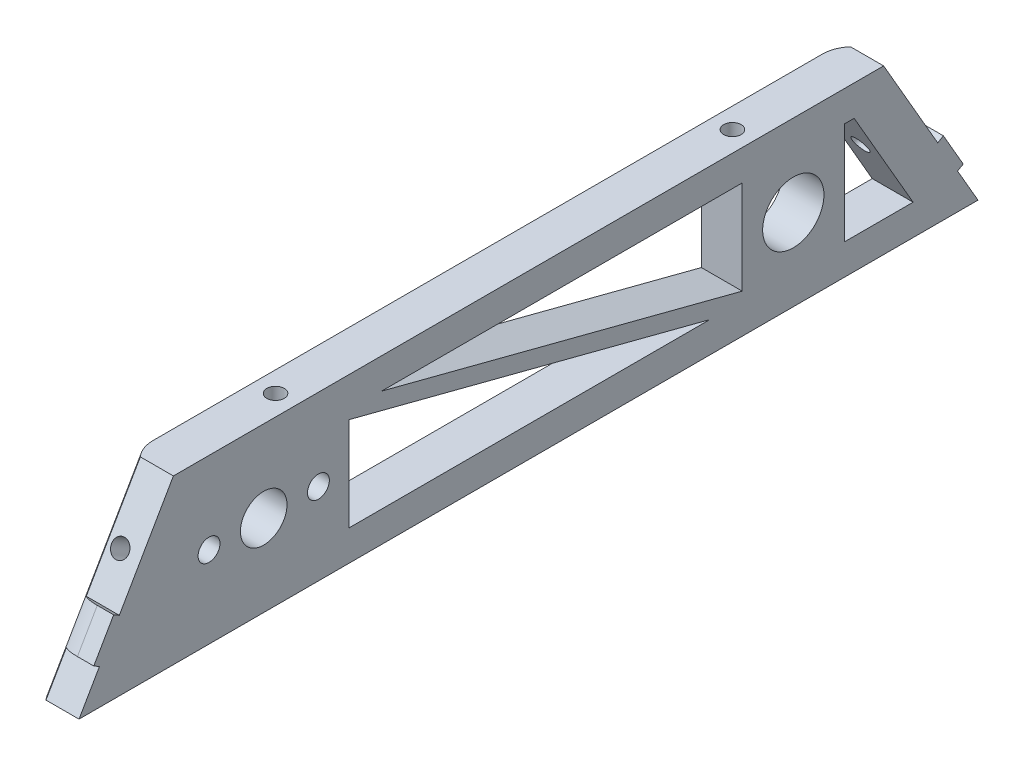
from build123d import *

# Parameters (mm, degrees)
SKETCH1_R                     = 3.6195
SKETCH1_R_2                   = 4.7625
SKETCH1_R_3                   = 1.6999966
BOSS_EXTRUDE1_DEPTH           = 6.35
TAP_DRILL_FOR_6_32_TAP4_D     = 2.7051
TAP_DRILL_FOR_6_32_TAP4_DEPTH = 10.16
TAP_DRILL_FOR_6_32_TAP4_TIP   = 0.81269403
TAP_DRILL_FOR_6_32_TAP3_D     = 2.7051
TAP_DRILL_FOR_6_32_TAP3_DEPTH = 10.16
TAP_DRILL_FOR_6_32_TAP3_TIP   = 0.81269403
SKETCH11_W                    = 6.35
SKETCH11_H                    = 6.1722
BOSS_EXTRUDE2_DEPTH           = 1.016
SKETCH12_W                    = 6.35
SKETCH12_H                    = 6.1722
BOSS_EXTRUDE3_DEPTH           = 1.016
TAP_DRILL_FOR_6_32_TAP1_D     = 2.7051
TAP_DRILL_FOR_6_32_TAP1_DEPTH = 7.62
TAP_DRILL_FOR_6_32_TAP1_TIP   = 0.81269403
TAP_DRILL_FOR_6_32_TAP2_D     = 2.7051
TAP_DRILL_FOR_6_32_TAP2_DEPTH = 7.62
TAP_DRILL_FOR_6_32_TAP2_TIP   = 0.81269403
CUT_EXTRUDE1_DEPTH            = 143.132235964
FILLET1_R                     = 3.81


with BuildPart() as part:
    # Sketch1 → Boss-Extrude1 (new body)
    with BuildSketch(Plane(origin=(0, 0, 0), x_dir=(0, 0, -1), z_dir=(1, 0, 0))):
        Polygon((0, 0), (-14.664696837, 25.4), (-125.035303163, 25.4), (-139.7, 0), align=None)
        with Locations((-110.998, 12.7)):
            Circle(SKETCH1_R, mode=Mode.SUBTRACT)
        with Locations((-28.702, 12.7)):
            Circle(SKETCH1_R_2, mode=Mode.SUBTRACT)
        with Locations((-102.4979916, 12.7)):
            Circle(SKETCH1_R_3, mode=Mode.SUBTRACT)
        with Locations((-119.4980084, 12.7)):
            Circle(SKETCH1_R_3, mode=Mode.SUBTRACT)
    extrude(amount=BOSS_EXTRUDE1_DEPTH)

    # Tap Drill for #6-32 Tap4
    with Locations(Plane(origin=(0, 25.4, 0), x_dir=(1, 0, 0), z_dir=(0, 1, 0))):
        with Locations((3.175, -105.985303163), (3.175, -34.984696837)):
            Hole(TAP_DRILL_FOR_6_32_TAP4_D / 2, depth=TAP_DRILL_FOR_6_32_TAP4_DEPTH)
            with Locations((0, 0, -(TAP_DRILL_FOR_6_32_TAP4_DEPTH + TAP_DRILL_FOR_6_32_TAP4_TIP / 2))):  # 118° drill point
                Cone(0, TAP_DRILL_FOR_6_32_TAP4_D / 2, TAP_DRILL_FOR_6_32_TAP4_TIP, mode=Mode.SUBTRACT)

    # Tap Drill for #6-32 Tap3
    with Locations(Plane(origin=(0, 0, 0), x_dir=(-1, 0, 0), z_dir=(0, -1, 0))):
        with Locations((-3.175, -105.41), (-3.175, -22.86)):
            Hole(TAP_DRILL_FOR_6_32_TAP3_D / 2, depth=TAP_DRILL_FOR_6_32_TAP3_DEPTH)
            with Locations((0, 0, -(TAP_DRILL_FOR_6_32_TAP3_DEPTH + TAP_DRILL_FOR_6_32_TAP3_TIP / 2))):  # 118° drill point
                Cone(0, TAP_DRILL_FOR_6_32_TAP3_D / 2, TAP_DRILL_FOR_6_32_TAP3_TIP, mode=Mode.SUBTRACT)

    # Sketch11 → Boss-Extrude2 (add)
    with BuildSketch(Plane(origin=(0, 60.491874454, 104.775), x_dir=(1, 0, 0), z_dir=(0, 0.5000000000000037, 0.8660254037844365))):
        with Locations((3.175, -60.4139)):
            Rectangle(SKETCH11_W, SKETCH11_H)
    extrude(amount=BOSS_EXTRUDE2_DEPTH)

    # Sketch12 → Boss-Extrude3 (add)
    with BuildSketch(Plane(origin=(0, 0, 0), x_dir=(-1, 0, 0), z_dir=(0, 0.49999999999999806, -0.8660254037844398))):
        with Locations((-3.175, 9.4361)):
            Rectangle(SKETCH12_W, SKETCH12_H)
    extrude(amount=BOSS_EXTRUDE3_DEPTH)

    # Tap Drill for #6-32 Tap1
    with Locations(Plane(origin=(0, 60.491874454, 104.775), x_dir=(1, 0, 0), z_dir=(0, 0.5000000000000037, 0.8660254037844365))):
        with Locations((3.175, -50.680606325)):
            Hole(TAP_DRILL_FOR_6_32_TAP1_D / 2, depth=TAP_DRILL_FOR_6_32_TAP1_DEPTH)
            with Locations((0, 0, -(TAP_DRILL_FOR_6_32_TAP1_DEPTH + TAP_DRILL_FOR_6_32_TAP1_TIP / 2))):  # 118° drill point
                Cone(0, TAP_DRILL_FOR_6_32_TAP1_D / 2, TAP_DRILL_FOR_6_32_TAP1_TIP, mode=Mode.SUBTRACT)

    # Tap Drill for #6-32 Tap2
    with Locations(Plane(origin=(0, 0, 0), x_dir=(-1, 0, 0), z_dir=(0, 0.49999999999999806, -0.8660254037844398))):
        with Locations((-3.175, 19.169393675)):
            Hole(TAP_DRILL_FOR_6_32_TAP2_D / 2, depth=TAP_DRILL_FOR_6_32_TAP2_DEPTH)
            with Locations((0, 0, -(TAP_DRILL_FOR_6_32_TAP2_DEPTH + TAP_DRILL_FOR_6_32_TAP2_TIP / 2))):  # 118° drill point
                Cone(0, TAP_DRILL_FOR_6_32_TAP2_D / 2, TAP_DRILL_FOR_6_32_TAP2_TIP, mode=Mode.SUBTRACT)

    # Sketch19 → Cut-Extrude1 (cut, through all)
    with BuildSketch(Plane.ZY):
        Polygon((92.68551049, 20.6375), (36.6395, 20.6375), (36.6395, 6.07467201), align=None)
        Polygon((97.7354916, 4.7625), (97.7354916, 19.32532799), (41.68948111, 4.7625), align=None)
        Polygon((20.7645, 20.6375), (20.7645, 4.7625), (10.081979076, 4.7625), (19.247414599, 20.6375), align=None)
    extrude(amount=-CUT_EXTRUDE1_DEPTH, mode=Mode.SUBTRACT)

    # Fillet1
    fillet1_edges = [part.edges().sort_by_distance(p)[0] for p in [
        (0, 8.679902313, 135.86183181),
        (0, 8.679902313, 3.83816819),
    ]]
    fillet(fillet1_edges, radius=FILLET1_R)


solid = part.part
